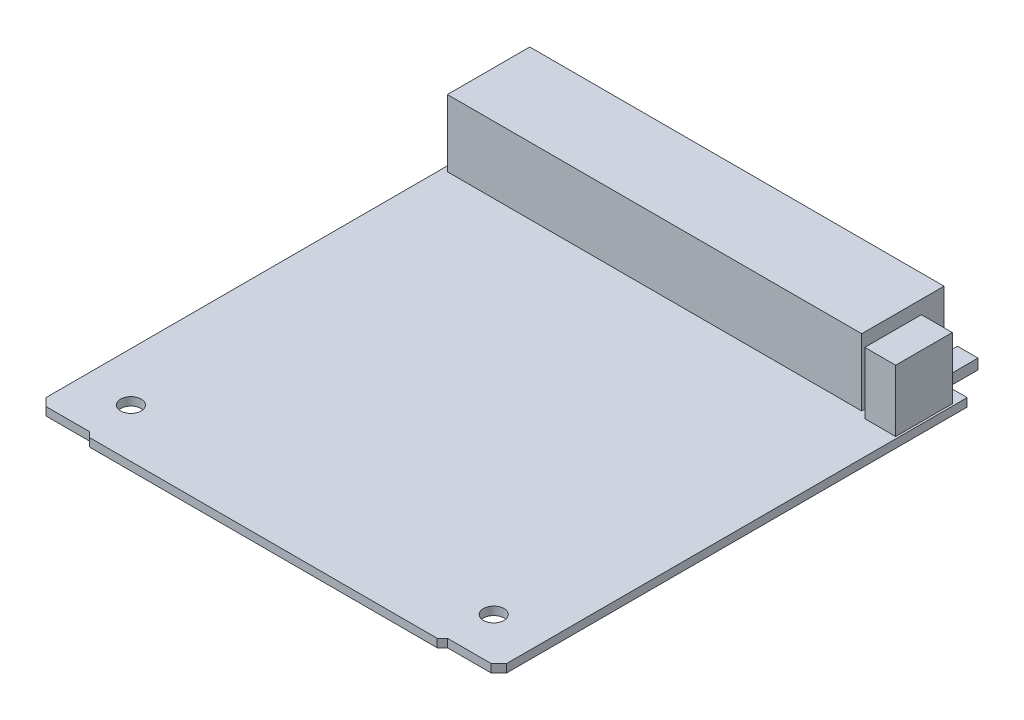
from build123d import *

# Parameters (mm, degrees)
BOSS_EXTRUDE1_DEPTH = 1.6
SKETCH2_W           = 80.5
SKETCH2_H           = 16
BOSS_EXTRUDE2_DEPTH = 13
CUT_EXTRUDE1_REACH  = 69.621
SKETCH3_R           = 2
CHAMFER1_SIZE       = 1.5
SKETCH4_W           = 6
SKETCH4_H           = 11
BOSS_EXTRUDE3_DEPTH = 12
SKETCH5_W           = 4
SKETCH5_H           = 2
BOSS_EXTRUDE4_DEPTH = 6


with BuildPart() as part:
    # Sketch1 → Boss-Extrude1 (new body)
    with BuildSketch(Plane(origin=(0, 0, 0), x_dir=(1, 0, 0), z_dir=(0, 1, 0))):
        Polygon((-44.75, 45.5), (44.75, 45.5), (44.75, -45.5), (34.75, -45.5), (33.75, -46.5), (-33.75, -46.5), (-34.75, -45.5), (-44.75, -45.5), align=None)
    extrude(amount=BOSS_EXTRUDE1_DEPTH)

    # Sketch2 → Boss-Extrude2 (add)
    with BuildSketch(Plane(origin=(0, 1.6, 0), x_dir=(1, 0, 0), z_dir=(0, 1, 0))):
        with Locations((-3.5, 41)):
            Rectangle(SKETCH2_W, SKETCH2_H)
    extrude(amount=BOSS_EXTRUDE2_DEPTH)

    # Sketch3 → Cut-Extrude1 (cut, up to next)
    with BuildSketch(Plane(origin=(0, 1.6, 0), x_dir=(1, 0, 0), z_dir=(0, 1, 0)), mode=Mode.PRIVATE) as cut_extrude1_sk1:
        with Locations(Location((-35.25, -37, 0), (0, 0, 270))):
            Circle(SKETCH3_R)
    cut_extrude1_tool1 = extrude(cut_extrude1_sk1.sketch, amount=-CUT_EXTRUDE1_REACH, mode=Mode.PRIVATE) & part.part
    # Sketch3 → Cut-Extrude1 (cut, up to next)
    with BuildSketch(Plane(origin=(0, 1.6, 0), x_dir=(1, 0, 0), z_dir=(0, 1, 0)), mode=Mode.PRIVATE) as cut_extrude1_sk2:
        with Locations(Location((35.25, -37, 0), (0, 0, 270))):
            Circle(SKETCH3_R)
    cut_extrude1_tool2 = extrude(cut_extrude1_sk2.sketch, amount=-CUT_EXTRUDE1_REACH, mode=Mode.PRIVATE) & part.part
    add(cut_extrude1_tool1.solids().sort_by_distance((-35.25, 1.6, 37))[0], mode=Mode.SUBTRACT)
    add(cut_extrude1_tool2.solids().sort_by_distance((35.25, 1.6, 37))[0], mode=Mode.SUBTRACT)

    # Chamfer1
    chamfer1_edges = [part.edges().sort_by_distance(p)[0] for p in [
        (44.75, 0.8, 45.5),
        (-44.75, 0.8, 45.5),
    ]]
    chamfer(chamfer1_edges, length=CHAMFER1_SIZE)

    # Sketch4 → Boss-Extrude3 (add)
    with BuildSketch(Plane(origin=(0, 1.6, 0), x_dir=(1, 0, 0), z_dir=(0, 1, 0))):
        with Locations((41.35, 37.5)):
            Rectangle(SKETCH4_W, SKETCH4_H)
    extrude(amount=BOSS_EXTRUDE3_DEPTH)

    # Sketch5 → Boss-Extrude4 (add)
    with BuildSketch(Plane(origin=(0, 0, -43), x_dir=(-1, 0, 0), z_dir=(0, 0, -1))):
        with Locations((-41.35, 4.8)):
            Rectangle(SKETCH5_W, SKETCH5_H)
    extrude(amount=BOSS_EXTRUDE4_DEPTH)


solid = part.part
